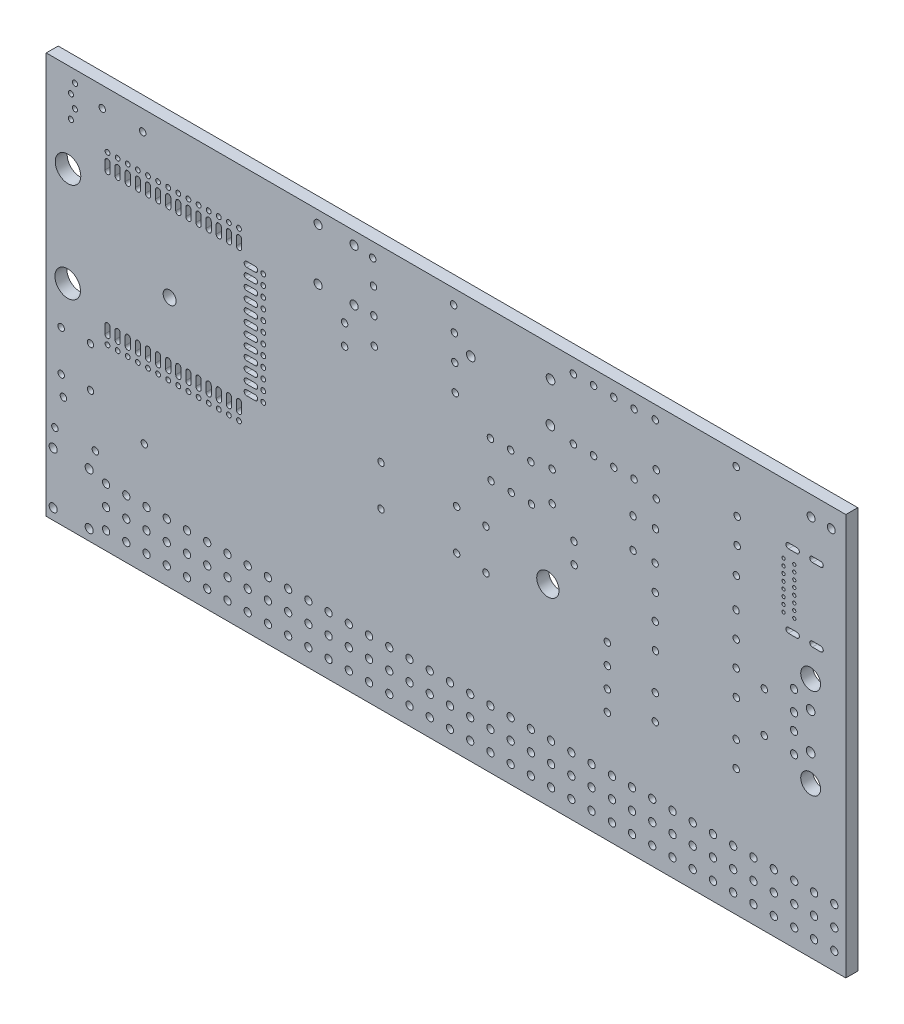
from build123d import *

# Parameters (mm, degrees)
SKETCH1_W           = 100.4
SKETCH1_H           = 50.4
SKETCH1_R           = 1.604875385
SKETCH1_R_2         = 0.457
SKETCH1_R_3         = 0.406
SKETCH1_R_4         = 0.508
SKETCH1_R_5         = 0.546
SKETCH1_R_6         = 1.4
SKETCH1_R_7         = 1.245
SKETCH1_R_8         = 0.45
SKETCH1_R_9         = 0.3
SKETCH1_R_10        = 0.325
SKETCH1_R_11        = 0.82
SKETCH1_R_12        = 0.203
SKETCH1_R_13        = 0.5
BOSS_EXTRUDE1_DEPTH = 1.5


with BuildPart() as part:
    # Sketch1 → Boss-Extrude1 (new body)
    with BuildSketch(Plane.XY):
        with Locations((51.575, 25.508)):
            Rectangle(SKETCH1_W, SKETCH1_H)
        with Locations((4.108084942, 39.459)):
            Circle(SKETCH1_R, mode=Mode.SUBTRACT)
        with Locations((26.67, 2.54)):
            Circle(SKETCH1_R_2, mode=Mode.SUBTRACT)
        with Locations((29.21, 2.54)):
            Circle(SKETCH1_R_2, mode=Mode.SUBTRACT)
        with Locations((21.59, 7.62)):
            Circle(SKETCH1_R_2, mode=Mode.SUBTRACT)
        with Locations((19.05, 7.62)):
            Circle(SKETCH1_R_2, mode=Mode.SUBTRACT)
        with Locations((24.13, 7.62)):
            Circle(SKETCH1_R_2, mode=Mode.SUBTRACT)
        with Locations((13.691, 14.351)):
            Circle(SKETCH1_R_3, mode=Mode.SUBTRACT)
        with Locations((7.544, 10.516)):
            Circle(SKETCH1_R_3, mode=Mode.SUBTRACT)
        with Locations((13.97, 7.62)):
            Circle(SKETCH1_R_2, mode=Mode.SUBTRACT)
        with Locations((16.51, 7.62)):
            Circle(SKETCH1_R_2, mode=Mode.SUBTRACT)
        with Locations((8.89, 7.62)):
            Circle(SKETCH1_R_2, mode=Mode.SUBTRACT)
        with Locations((11.43, 7.62)):
            Circle(SKETCH1_R_2, mode=Mode.SUBTRACT)
        with Locations((6.934, 21.869)):
            Circle(SKETCH1_R_3, mode=Mode.SUBTRACT)
        with Locations((6.934, 16.789)):
            Circle(SKETCH1_R_3, mode=Mode.SUBTRACT)
        with Locations((3.251, 21.793)):
            Circle(SKETCH1_R_3, mode=Mode.SUBTRACT)
        with Locations((3.251, 16.713)):
            Circle(SKETCH1_R_3, mode=Mode.SUBTRACT)
        with Locations((3.531, 14.351)):
            Circle(SKETCH1_R_3, mode=Mode.SUBTRACT)
        with Locations((6.768, 8.179)):
            Circle(SKETCH1_R_4, mode=Mode.SUBTRACT)
        with Locations((2.464, 10.516)):
            Circle(SKETCH1_R_3, mode=Mode.SUBTRACT)
        with Locations((2.247, 8.179)):
            Circle(SKETCH1_R_4, mode=Mode.SUBTRACT)
        with Locations((24.13, 5.08)):
            Circle(SKETCH1_R_2, mode=Mode.SUBTRACT)
        with Locations((21.59, 5.08)):
            Circle(SKETCH1_R_2, mode=Mode.SUBTRACT)
        with Locations((26.67, 5.08)):
            Circle(SKETCH1_R_2, mode=Mode.SUBTRACT)
        with Locations((16.51, 5.08)):
            Circle(SKETCH1_R_2, mode=Mode.SUBTRACT)
        with Locations((19.05, 5.08)):
            Circle(SKETCH1_R_2, mode=Mode.SUBTRACT)
        with Locations((21.59, 2.54)):
            Circle(SKETCH1_R_2, mode=Mode.SUBTRACT)
        with Locations((24.13, 2.54)):
            Circle(SKETCH1_R_2, mode=Mode.SUBTRACT)
        with Locations((16.51, 2.54)):
            Circle(SKETCH1_R_2, mode=Mode.SUBTRACT)
        with Locations((19.05, 2.54)):
            Circle(SKETCH1_R_2, mode=Mode.SUBTRACT)
        with Locations((13.97, 5.08)):
            Circle(SKETCH1_R_2, mode=Mode.SUBTRACT)
        with Locations((13.97, 2.54)):
            Circle(SKETCH1_R_2, mode=Mode.SUBTRACT)
        with Locations((8.89, 5.08)):
            Circle(SKETCH1_R_2, mode=Mode.SUBTRACT)
        with Locations((11.43, 5.08)):
            Circle(SKETCH1_R_2, mode=Mode.SUBTRACT)
        with Locations((8.89, 2.54)):
            Circle(SKETCH1_R_2, mode=Mode.SUBTRACT)
        with Locations((11.43, 2.54)):
            Circle(SKETCH1_R_2, mode=Mode.SUBTRACT)
        with Locations((2.247, 1.676)):
            Circle(SKETCH1_R_4, mode=Mode.SUBTRACT)
        with Locations((6.768, 1.676)):
            Circle(SKETCH1_R_4, mode=Mode.SUBTRACT)
        with Locations((75.184, 48.895)):
            Circle(SKETCH1_R_3, mode=Mode.SUBTRACT)
        with Locations((77.978, 43.688)):
            Circle(SKETCH1_R_3, mode=Mode.SUBTRACT)
        with Locations((72.644, 48.895)):
            Circle(SKETCH1_R_3, mode=Mode.SUBTRACT)
        with Locations((75.184, 41.275)):
            Circle(SKETCH1_R_3, mode=Mode.SUBTRACT)
        with Locations((77.978, 40.513)):
            Circle(SKETCH1_R_3, mode=Mode.SUBTRACT)
        with Locations((77.876, 37.211)):
            Circle(SKETCH1_R_3, mode=Mode.SUBTRACT)
        with Locations((72.644, 41.275)):
            Circle(SKETCH1_R_3, mode=Mode.SUBTRACT)
        with Locations((75.057, 37.211)):
            Circle(SKETCH1_R_3, mode=Mode.SUBTRACT)
        with Locations((67.564, 48.895)):
            Circle(SKETCH1_R_3, mode=Mode.SUBTRACT)
        with Locations((70.104, 48.895)):
            Circle(SKETCH1_R_3, mode=Mode.SUBTRACT)
        with Locations((64.7, 46.874)):
            Circle(SKETCH1_R_5, mode=Mode.SUBTRACT)
        with Locations((64.68, 41.874)):
            Circle(SKETCH1_R_5, mode=Mode.SUBTRACT)
        with Locations((67.564, 41.275)):
            Circle(SKETCH1_R_3, mode=Mode.SUBTRACT)
        with Locations((70.104, 41.275)):
            Circle(SKETCH1_R_3, mode=Mode.SUBTRACT)
        with Locations((64.897, 37.211)):
            Circle(SKETCH1_R_3, mode=Mode.SUBTRACT)
        with Locations((57.15, 36.678)):
            Circle(SKETCH1_R_3, mode=Mode.SUBTRACT)
        with Locations((87.986, 33.452)):
            Circle(SKETCH1_R_3, mode=Mode.SUBTRACT)
        with Locations((77.826, 33.452)):
            Circle(SKETCH1_R_3, mode=Mode.SUBTRACT)
        with Locations((77.851, 30.277)):
            Circle(SKETCH1_R_3, mode=Mode.SUBTRACT)
        with Locations((75.057, 33.452)):
            Circle(SKETCH1_R_3, mode=Mode.SUBTRACT)
        with Locations((67.64, 30.734)):
            Circle(SKETCH1_R_3, mode=Mode.SUBTRACT)
        with Locations((88.011, 30.277)):
            Circle(SKETCH1_R_3, mode=Mode.SUBTRACT)
        with Locations((77.876, 23.952)):
            Circle(SKETCH1_R_3, mode=Mode.SUBTRACT)
        with Locations((67.666, 28.194)):
            Circle(SKETCH1_R_3, mode=Mode.SUBTRACT)
        with Locations((77.851, 27.127)):
            Circle(SKETCH1_R_3, mode=Mode.SUBTRACT)
        with Locations((64.897, 33.452)):
            Circle(SKETCH1_R_3, mode=Mode.SUBTRACT)
        with Locations((62.306, 32.106)):
            Circle(SKETCH1_R_3, mode=Mode.SUBTRACT)
        with Locations((59.69, 36.678)):
            Circle(SKETCH1_R_3, mode=Mode.SUBTRACT)
        with Locations((62.23, 36.678)):
            Circle(SKETCH1_R_3, mode=Mode.SUBTRACT)
        with Locations((59.766, 32.106)):
            Circle(SKETCH1_R_3, mode=Mode.SUBTRACT)
        with Locations((64.364, 24.435)):
            Circle(SKETCH1_R_6, mode=Mode.SUBTRACT)
        with Locations((57.226, 32.106)):
            Circle(SKETCH1_R_3, mode=Mode.SUBTRACT)
        with Locations((56.591, 26.848)):
            Circle(SKETCH1_R_3, mode=Mode.SUBTRACT)
        with Locations((97.358, 19.253)):
            Circle(SKETCH1_R_7, mode=Mode.SUBTRACT)
        with Locations((95.301, 7.645)):
            Circle(SKETCH1_R_2, mode=Mode.SUBTRACT)
        with Locations((97.79, 7.62)):
            Circle(SKETCH1_R_2, mode=Mode.SUBTRACT)
        with Locations((91.542, 21.565)):
            Circle(SKETCH1_R_3, mode=Mode.SUBTRACT)
        with Locations((95.275, 21.387)):
            Circle(SKETCH1_R_8, mode=Mode.SUBTRACT)
        with Locations((100.33, 7.62)):
            Circle(SKETCH1_R_2, mode=Mode.SUBTRACT)
        with Locations((95.301, 5.105)):
            Circle(SKETCH1_R_2, mode=Mode.SUBTRACT)
        with Locations((90.17, 7.62)):
            Circle(SKETCH1_R_2, mode=Mode.SUBTRACT)
        with Locations((92.735, 7.62)):
            Circle(SKETCH1_R_2, mode=Mode.SUBTRACT)
        with Locations((88.011, 19.38)):
            Circle(SKETCH1_R_3, mode=Mode.SUBTRACT)
        with Locations((88.011, 16.205)):
            Circle(SKETCH1_R_3, mode=Mode.SUBTRACT)
        with Locations((77.851, 19.38)):
            Circle(SKETCH1_R_3, mode=Mode.SUBTRACT)
        with Locations((77.851, 16.205)):
            Circle(SKETCH1_R_3, mode=Mode.SUBTRACT)
        with Locations((85.09, 7.62)):
            Circle(SKETCH1_R_2, mode=Mode.SUBTRACT)
        with Locations((87.63, 7.62)):
            Circle(SKETCH1_R_2, mode=Mode.SUBTRACT)
        with Locations((80.01, 7.62)):
            Circle(SKETCH1_R_2, mode=Mode.SUBTRACT)
        with Locations((82.55, 7.62)):
            Circle(SKETCH1_R_2, mode=Mode.SUBTRACT)
        with Locations((100.33, 5.08)):
            Circle(SKETCH1_R_2, mode=Mode.SUBTRACT)
        with Locations((97.79, 5.08)):
            Circle(SKETCH1_R_2, mode=Mode.SUBTRACT)
        with Locations((95.301, 2.565)):
            Circle(SKETCH1_R_2, mode=Mode.SUBTRACT)
        with Locations((90.17, 5.08)):
            Circle(SKETCH1_R_2, mode=Mode.SUBTRACT)
        with Locations((92.735, 5.08)):
            Circle(SKETCH1_R_2, mode=Mode.SUBTRACT)
        with Locations((97.79, 2.54)):
            Circle(SKETCH1_R_2, mode=Mode.SUBTRACT)
        with Locations((100.33, 2.54)):
            Circle(SKETCH1_R_2, mode=Mode.SUBTRACT)
        with Locations((90.17, 2.54)):
            Circle(SKETCH1_R_2, mode=Mode.SUBTRACT)
        with Locations((92.735, 2.54)):
            Circle(SKETCH1_R_2, mode=Mode.SUBTRACT)
        with Locations((85.09, 5.08)):
            Circle(SKETCH1_R_2, mode=Mode.SUBTRACT)
        with Locations((87.63, 5.08)):
            Circle(SKETCH1_R_2, mode=Mode.SUBTRACT)
        with Locations((80.01, 5.08)):
            Circle(SKETCH1_R_2, mode=Mode.SUBTRACT)
        with Locations((82.55, 5.08)):
            Circle(SKETCH1_R_2, mode=Mode.SUBTRACT)
        with Locations((85.09, 2.54)):
            Circle(SKETCH1_R_2, mode=Mode.SUBTRACT)
        with Locations((87.63, 2.54)):
            Circle(SKETCH1_R_2, mode=Mode.SUBTRACT)
        with Locations((80.01, 2.54)):
            Circle(SKETCH1_R_2, mode=Mode.SUBTRACT)
        with Locations((82.55, 2.54)):
            Circle(SKETCH1_R_2, mode=Mode.SUBTRACT)
        with Locations((71.832, 14.226)):
            Circle(SKETCH1_R_3, mode=Mode.SUBTRACT)
        with Locations((71.832, 16.766)):
            Circle(SKETCH1_R_3, mode=Mode.SUBTRACT)
        with Locations((77.47, 7.645)):
            Circle(SKETCH1_R_2, mode=Mode.SUBTRACT)
        with Locations((71.832, 21.846)):
            Circle(SKETCH1_R_3, mode=Mode.SUBTRACT)
        with Locations((71.832, 19.306)):
            Circle(SKETCH1_R_3, mode=Mode.SUBTRACT)
        with Locations((74.93, 7.62)):
            Circle(SKETCH1_R_2, mode=Mode.SUBTRACT)
        with Locations((77.47, 5.105)):
            Circle(SKETCH1_R_2, mode=Mode.SUBTRACT)
        with Locations((69.85, 7.62)):
            Circle(SKETCH1_R_2, mode=Mode.SUBTRACT)
        with Locations((72.415, 7.62)):
            Circle(SKETCH1_R_2, mode=Mode.SUBTRACT)
        with Locations((64.77, 7.62)):
            Circle(SKETCH1_R_2, mode=Mode.SUBTRACT)
        with Locations((67.31, 7.62)):
            Circle(SKETCH1_R_2, mode=Mode.SUBTRACT)
        with Locations((56.591, 21.768)):
            Circle(SKETCH1_R_3, mode=Mode.SUBTRACT)
        with Locations((62.23, 7.62)):
            Circle(SKETCH1_R_2, mode=Mode.SUBTRACT)
        with Locations((59.69, 7.62)):
            Circle(SKETCH1_R_2, mode=Mode.SUBTRACT)
        with Locations((69.85, 5.08)):
            Circle(SKETCH1_R_2, mode=Mode.SUBTRACT)
        with Locations((54.61, 7.62)):
            Circle(SKETCH1_R_2, mode=Mode.SUBTRACT)
        with Locations((57.15, 7.62)):
            Circle(SKETCH1_R_2, mode=Mode.SUBTRACT)
        with Locations((74.93, 5.08)):
            Circle(SKETCH1_R_2, mode=Mode.SUBTRACT)
        with Locations((72.415, 5.08)):
            Circle(SKETCH1_R_2, mode=Mode.SUBTRACT)
        with Locations((77.47, 2.565)):
            Circle(SKETCH1_R_2, mode=Mode.SUBTRACT)
        with Locations((64.77, 5.08)):
            Circle(SKETCH1_R_2, mode=Mode.SUBTRACT)
        with Locations((67.31, 5.08)):
            Circle(SKETCH1_R_2, mode=Mode.SUBTRACT)
        with Locations((72.415, 2.54)):
            Circle(SKETCH1_R_2, mode=Mode.SUBTRACT)
        with Locations((74.93, 2.54)):
            Circle(SKETCH1_R_2, mode=Mode.SUBTRACT)
        with Locations((67.31, 2.54)):
            Circle(SKETCH1_R_2, mode=Mode.SUBTRACT)
        with Locations((69.85, 2.54)):
            Circle(SKETCH1_R_2, mode=Mode.SUBTRACT)
        with Locations((59.69, 5.08)):
            Circle(SKETCH1_R_2, mode=Mode.SUBTRACT)
        with Locations((62.23, 5.08)):
            Circle(SKETCH1_R_2, mode=Mode.SUBTRACT)
        with Locations((57.15, 5.08)):
            Circle(SKETCH1_R_2, mode=Mode.SUBTRACT)
        with Locations((54.61, 2.54)):
            Circle(SKETCH1_R_2, mode=Mode.SUBTRACT)
        with Locations((62.23, 2.54)):
            Circle(SKETCH1_R_2, mode=Mode.SUBTRACT)
        with Locations((64.77, 2.54)):
            Circle(SKETCH1_R_2, mode=Mode.SUBTRACT)
        with Locations((57.15, 2.54)):
            Circle(SKETCH1_R_2, mode=Mode.SUBTRACT)
        with Locations((59.69, 2.54)):
            Circle(SKETCH1_R_2, mode=Mode.SUBTRACT)
        with Locations((52.629, 45.898)):
            Circle(SKETCH1_R_3, mode=Mode.SUBTRACT)
        with Locations((52.527, 48.895)):
            Circle(SKETCH1_R_3, mode=Mode.SUBTRACT)
        with Locations((54.69, 44.374)):
            Circle(SKETCH1_R_5, mode=Mode.SUBTRACT)
        with Locations((42.367, 48.895)):
            Circle(SKETCH1_R_3, mode=Mode.SUBTRACT)
        with Locations((42.469, 45.898)):
            Circle(SKETCH1_R_3, mode=Mode.SUBTRACT)
        with Locations((52.68, 42.697)):
            Circle(SKETCH1_R_3, mode=Mode.SUBTRACT)
        with Locations((52.73, 39.421)):
            Circle(SKETCH1_R_3, mode=Mode.SUBTRACT)
        with Locations((42.52, 42.697)):
            Circle(SKETCH1_R_3, mode=Mode.SUBTRACT)
        with Locations((42.57, 39.421)):
            Circle(SKETCH1_R_3, mode=Mode.SUBTRACT)
        with Locations((40.03, 49.124)):
            Circle(SKETCH1_R_4, mode=Mode.SUBTRACT)
        with Locations((35.509, 49.124)):
            Circle(SKETCH1_R_4, mode=Mode.SUBTRACT)
        with Locations((25.581, 43.739)):
            Circle(SKETCH1_R_9, mode=Mode.SUBTRACT)
        with Locations((23.041, 43.739)):
            Circle(SKETCH1_R_9, mode=Mode.SUBTRACT)
        with Locations((24.311, 43.739)):
            Circle(SKETCH1_R_9, mode=Mode.SUBTRACT)
        with Locations((40.03, 42.621)):
            Circle(SKETCH1_R_4, mode=Mode.SUBTRACT)
        with Locations((38.837, 40.081)):
            Circle(SKETCH1_R_3, mode=Mode.SUBTRACT)
        with Locations((35.509, 42.621)):
            Circle(SKETCH1_R_4, mode=Mode.SUBTRACT)
        with Locations((28.626, 40.304)):
            Circle(SKETCH1_R_9, mode=Mode.SUBTRACT)
        with Locations((28.626, 37.764)):
            Circle(SKETCH1_R_9, mode=Mode.SUBTRACT)
        with Locations((28.626, 39.034)):
            Circle(SKETCH1_R_9, mode=Mode.SUBTRACT)
        with Locations((38.837, 37.541)):
            Circle(SKETCH1_R_3, mode=Mode.SUBTRACT)
        with Locations((28.626, 35.224)):
            Circle(SKETCH1_R_9, mode=Mode.SUBTRACT)
        with Locations((28.626, 33.954)):
            Circle(SKETCH1_R_9, mode=Mode.SUBTRACT)
        with Locations((43.409, 27.203)):
            Circle(SKETCH1_R_3, mode=Mode.SUBTRACT)
        with Locations((52.908, 27.153)):
            Circle(SKETCH1_R_3, mode=Mode.SUBTRACT)
        with Locations((28.626, 32.684)):
            Circle(SKETCH1_R_9, mode=Mode.SUBTRACT)
        with Locations((43.409, 22.123)):
            Circle(SKETCH1_R_3, mode=Mode.SUBTRACT)
        with Locations((28.626, 30.144)):
            Circle(SKETCH1_R_9, mode=Mode.SUBTRACT)
        with Locations((28.626, 28.874)):
            Circle(SKETCH1_R_9, mode=Mode.SUBTRACT)
        with Locations((28.626, 36.494)):
            Circle(SKETCH1_R_9, mode=Mode.SUBTRACT)
        with Locations((28.626, 31.414)):
            Circle(SKETCH1_R_9, mode=Mode.SUBTRACT)
        with Locations((28.626, 27.604)):
            Circle(SKETCH1_R_9, mode=Mode.SUBTRACT)
        with Locations((28.626, 26.334)):
            Circle(SKETCH1_R_9, mode=Mode.SUBTRACT)
        with Locations((24.311, 22.809)):
            Circle(SKETCH1_R_9, mode=Mode.SUBTRACT)
        with Locations((25.581, 22.809)):
            Circle(SKETCH1_R_9, mode=Mode.SUBTRACT)
        with Locations((20.501, 43.739)):
            Circle(SKETCH1_R_9, mode=Mode.SUBTRACT)
        with Locations((19.231, 43.739)):
            Circle(SKETCH1_R_9, mode=Mode.SUBTRACT)
        with Locations((21.771, 43.739)):
            Circle(SKETCH1_R_9, mode=Mode.SUBTRACT)
        with Locations((13.487, 48.184)):
            Circle(SKETCH1_R_3, mode=Mode.SUBTRACT)
        with Locations((17.961, 43.739)):
            Circle(SKETCH1_R_9, mode=Mode.SUBTRACT)
        with Locations((15.421, 43.739)):
            Circle(SKETCH1_R_9, mode=Mode.SUBTRACT)
        with Locations((16.691, 43.739)):
            Circle(SKETCH1_R_9, mode=Mode.SUBTRACT)
        with Locations((12.881, 43.739)):
            Circle(SKETCH1_R_9, mode=Mode.SUBTRACT)
        with Locations((14.151, 43.739)):
            Circle(SKETCH1_R_9, mode=Mode.SUBTRACT)
        with Locations((4.98, 49.219)):
            Circle(SKETCH1_R_10, mode=Mode.SUBTRACT)
        with Locations((8.407, 48.184)):
            Circle(SKETCH1_R_3, mode=Mode.SUBTRACT)
        with Locations((4.472, 47.822)):
            Circle(SKETCH1_R_10, mode=Mode.SUBTRACT)
        with Locations((4.98, 46.425)):
            Circle(SKETCH1_R_10, mode=Mode.SUBTRACT)
        with Locations((10.341, 43.739)):
            Circle(SKETCH1_R_9, mode=Mode.SUBTRACT)
        with Locations((11.611, 43.739)):
            Circle(SKETCH1_R_9, mode=Mode.SUBTRACT)
        with Locations((4.472, 45.028)):
            Circle(SKETCH1_R_10, mode=Mode.SUBTRACT)
        with Locations((9.071, 43.739)):
            Circle(SKETCH1_R_9, mode=Mode.SUBTRACT)
        with Locations((21.771, 22.809)):
            Circle(SKETCH1_R_9, mode=Mode.SUBTRACT)
        with Locations((20.501, 22.809)):
            Circle(SKETCH1_R_9, mode=Mode.SUBTRACT)
        with Locations((23.041, 22.809)):
            Circle(SKETCH1_R_9, mode=Mode.SUBTRACT)
        with Locations((16.871, 31.862)):
            Circle(SKETCH1_R_11, mode=Mode.SUBTRACT)
        with Locations((19.231, 22.809)):
            Circle(SKETCH1_R_9, mode=Mode.SUBTRACT)
        with Locations((16.691, 22.809)):
            Circle(SKETCH1_R_9, mode=Mode.SUBTRACT)
        with Locations((17.961, 22.809)):
            Circle(SKETCH1_R_9, mode=Mode.SUBTRACT)
        with Locations((14.151, 22.809)):
            Circle(SKETCH1_R_9, mode=Mode.SUBTRACT)
        with Locations((15.421, 22.809)):
            Circle(SKETCH1_R_9, mode=Mode.SUBTRACT)
        with Locations((95.301, 36.182)):
            Circle(SKETCH1_R_12, mode=Mode.SUBTRACT)
        with Locations((97.358, 27.229)):
            Circle(SKETCH1_R_5, mode=Mode.SUBTRACT)
        with Locations((97.358, 22.644)):
            Circle(SKETCH1_R_5, mode=Mode.SUBTRACT)
        with Locations((95.275, 25.959)):
            Circle(SKETCH1_R_8, mode=Mode.SUBTRACT)
        with Locations((95.275, 23.927)):
            Circle(SKETCH1_R_8, mode=Mode.SUBTRACT)
        with Locations((93.955, 37.859)):
            Circle(SKETCH1_R_12, mode=Mode.SUBTRACT)
        with Locations((93.955, 37.02)):
            Circle(SKETCH1_R_12, mode=Mode.SUBTRACT)
        with Locations((88.036, 37.211)):
            Circle(SKETCH1_R_3, mode=Mode.SUBTRACT)
        with Locations((93.955, 36.182)):
            Circle(SKETCH1_R_12, mode=Mode.SUBTRACT)
        with Locations((91.542, 26.645)):
            Circle(SKETCH1_R_3, mode=Mode.SUBTRACT)
        with Locations((88.011, 27.127)):
            Circle(SKETCH1_R_3, mode=Mode.SUBTRACT)
        with Locations((88.036, 23.952)):
            Circle(SKETCH1_R_3, mode=Mode.SUBTRACT)
        with Locations((77.851, 49.047)):
            Circle(SKETCH1_R_3, mode=Mode.SUBTRACT)
        with Locations((95.301, 38.697)):
            Circle(SKETCH1_R_12, mode=Mode.SUBTRACT)
        with Locations((95.301, 37.859)):
            Circle(SKETCH1_R_12, mode=Mode.SUBTRACT)
        with Locations((95.301, 40.373)):
            Circle(SKETCH1_R_12, mode=Mode.SUBTRACT)
        with Locations((95.301, 39.535)):
            Circle(SKETCH1_R_12, mode=Mode.SUBTRACT)
        with Locations((93.955, 42.05)):
            Circle(SKETCH1_R_12, mode=Mode.SUBTRACT)
        with Locations((93.955, 41.212)):
            Circle(SKETCH1_R_12, mode=Mode.SUBTRACT)
        with Locations((88.011, 49.047)):
            Circle(SKETCH1_R_3, mode=Mode.SUBTRACT)
        with Locations((88.138, 43.688)):
            Circle(SKETCH1_R_3, mode=Mode.SUBTRACT)
        with Locations((93.955, 40.373)):
            Circle(SKETCH1_R_12, mode=Mode.SUBTRACT)
        with Locations((93.955, 39.535)):
            Circle(SKETCH1_R_12, mode=Mode.SUBTRACT)
        with Locations((88.138, 40.513)):
            Circle(SKETCH1_R_3, mode=Mode.SUBTRACT)
        with Locations((93.955, 38.697)):
            Circle(SKETCH1_R_12, mode=Mode.SUBTRACT)
        with Locations((97.358, 30.632)):
            Circle(SKETCH1_R_7, mode=Mode.SUBTRACT)
        with Locations((95.275, 28.499)):
            Circle(SKETCH1_R_8, mode=Mode.SUBTRACT)
        with Locations((95.301, 37.02)):
            Circle(SKETCH1_R_12, mode=Mode.SUBTRACT)
        with Locations((34.29, 2.54)):
            Circle(SKETCH1_R_2, mode=Mode.SUBTRACT)
        with Locations((31.75, 2.54)):
            Circle(SKETCH1_R_2, mode=Mode.SUBTRACT)
        with Locations((34.29, 5.08)):
            Circle(SKETCH1_R_2, mode=Mode.SUBTRACT)
        with Locations((31.75, 5.08)):
            Circle(SKETCH1_R_2, mode=Mode.SUBTRACT)
        with Locations((36.83, 2.54)):
            Circle(SKETCH1_R_2, mode=Mode.SUBTRACT)
        with Locations((36.83, 5.08)):
            Circle(SKETCH1_R_2, mode=Mode.SUBTRACT)
        with Locations((41.91, 2.54)):
            Circle(SKETCH1_R_2, mode=Mode.SUBTRACT)
        with Locations((39.37, 2.54)):
            Circle(SKETCH1_R_2, mode=Mode.SUBTRACT)
        with Locations((46.99, 2.54)):
            Circle(SKETCH1_R_2, mode=Mode.SUBTRACT)
        with Locations((44.45, 2.54)):
            Circle(SKETCH1_R_2, mode=Mode.SUBTRACT)
        with Locations((41.91, 5.08)):
            Circle(SKETCH1_R_2, mode=Mode.SUBTRACT)
        with Locations((39.37, 5.08)):
            Circle(SKETCH1_R_2, mode=Mode.SUBTRACT)
        with Locations((49.53, 2.54)):
            Circle(SKETCH1_R_2, mode=Mode.SUBTRACT)
        with Locations((52.07, 5.08)):
            Circle(SKETCH1_R_2, mode=Mode.SUBTRACT)
        with Locations((52.07, 2.54)):
            Circle(SKETCH1_R_2, mode=Mode.SUBTRACT)
        with Locations((29.21, 5.08)):
            Circle(SKETCH1_R_2, mode=Mode.SUBTRACT)
        with Locations((26.67, 7.62)):
            Circle(SKETCH1_R_2, mode=Mode.SUBTRACT)
        with Locations((31.75, 7.62)):
            Circle(SKETCH1_R_2, mode=Mode.SUBTRACT)
        with Locations((29.21, 7.62)):
            Circle(SKETCH1_R_2, mode=Mode.SUBTRACT)
        with Locations((36.83, 7.62)):
            Circle(SKETCH1_R_2, mode=Mode.SUBTRACT)
        with Locations((34.29, 7.62)):
            Circle(SKETCH1_R_2, mode=Mode.SUBTRACT)
        with Locations((41.91, 7.62)):
            Circle(SKETCH1_R_2, mode=Mode.SUBTRACT)
        with Locations((39.37, 7.62)):
            Circle(SKETCH1_R_2, mode=Mode.SUBTRACT)
        with Locations((46.99, 5.08)):
            Circle(SKETCH1_R_2, mode=Mode.SUBTRACT)
        with Locations((44.45, 5.08)):
            Circle(SKETCH1_R_2, mode=Mode.SUBTRACT)
        with Locations((54.61, 5.08)):
            Circle(SKETCH1_R_2, mode=Mode.SUBTRACT)
        with Locations((49.53, 5.08)):
            Circle(SKETCH1_R_2, mode=Mode.SUBTRACT)
        with Locations((46.99, 7.62)):
            Circle(SKETCH1_R_2, mode=Mode.SUBTRACT)
        with Locations((95.301, 41.212)):
            Circle(SKETCH1_R_12, mode=Mode.SUBTRACT)
        with Locations((95.301, 42.05)):
            Circle(SKETCH1_R_12, mode=Mode.SUBTRACT)
        with Locations((9.071, 22.809)):
            Circle(SKETCH1_R_9, mode=Mode.SUBTRACT)
        with Locations((10.341, 22.809)):
            Circle(SKETCH1_R_9, mode=Mode.SUBTRACT)
        with Locations((52.908, 22.073)):
            Circle(SKETCH1_R_3, mode=Mode.SUBTRACT)
        with Locations((52.07, 7.62)):
            Circle(SKETCH1_R_2, mode=Mode.SUBTRACT)
        with Locations((49.53, 7.62)):
            Circle(SKETCH1_R_2, mode=Mode.SUBTRACT)
        with Locations((44.45, 7.62)):
            Circle(SKETCH1_R_2, mode=Mode.SUBTRACT)
        with Locations((11.611, 22.809)):
            Circle(SKETCH1_R_9, mode=Mode.SUBTRACT)
        with Locations((12.881, 22.809)):
            Circle(SKETCH1_R_9, mode=Mode.SUBTRACT)
        with Locations((97.409, 48.26)):
            Circle(SKETCH1_R_13, mode=Mode.SUBTRACT)
        with Locations((99.949, 48.26)):
            Circle(SKETCH1_R_13, mode=Mode.SUBTRACT)
        with Locations((4.067, 26.975)):
            Circle(SKETCH1_R, mode=Mode.SUBTRACT)
        with BuildLine():
            Line((9.396, 42.714), (9.396, 41.664))
            ThreePointArc((9.396, 41.664), (9.071, 41.339), (8.746, 41.664))
            Line((8.746, 41.664), (8.746, 42.714))
            ThreePointArc((8.746, 42.714), (9.071, 43.039), (9.396, 42.714))
        make_face(mode=Mode.SUBTRACT)
        with BuildLine():
            Line((27.601, 39.979), (26.551, 39.979))
            ThreePointArc((26.551, 39.979), (26.226, 40.304), (26.551, 40.629))
            Line((26.551, 40.629), (27.601, 40.629))
            ThreePointArc((27.601, 40.629), (27.926, 40.304), (27.601, 39.979))
        make_face(mode=Mode.SUBTRACT)
        with BuildLine():
            Line((8.746, 23.834), (8.746, 24.884))
            ThreePointArc((8.746, 24.884), (9.071, 25.209), (9.396, 24.884))
            Line((9.396, 24.884), (9.396, 23.834))
            ThreePointArc((9.396, 23.834), (9.071, 23.509), (8.746, 23.834))
        make_face(mode=Mode.SUBTRACT)
        with BuildLine():
            Line((10.016, 23.834), (10.016, 24.884))
            ThreePointArc((10.016, 24.884), (10.341, 25.209), (10.666, 24.884))
            Line((10.666, 24.884), (10.666, 23.834))
            ThreePointArc((10.666, 23.834), (10.341, 23.509), (10.016, 23.834))
        make_face(mode=Mode.SUBTRACT)
        with BuildLine():
            Line((11.286, 23.834), (11.286, 24.884))
            ThreePointArc((11.286, 24.884), (11.611, 25.209), (11.936, 24.884))
            Line((11.936, 24.884), (11.936, 23.834))
            ThreePointArc((11.936, 23.834), (11.611, 23.509), (11.286, 23.834))
        make_face(mode=Mode.SUBTRACT)
        with BuildLine():
            Line((12.556, 23.834), (12.556, 24.884))
            ThreePointArc((12.556, 24.884), (12.881, 25.209), (13.206, 24.884))
            Line((13.206, 24.884), (13.206, 23.834))
            ThreePointArc((13.206, 23.834), (12.881, 23.509), (12.556, 23.834))
        make_face(mode=Mode.SUBTRACT)
        with BuildLine():
            Line((13.826, 23.834), (13.826, 24.884))
            ThreePointArc((13.826, 24.884), (14.151, 25.209), (14.476, 24.884))
            Line((14.476, 24.884), (14.476, 23.834))
            ThreePointArc((14.476, 23.834), (14.151, 23.509), (13.826, 23.834))
        make_face(mode=Mode.SUBTRACT)
        with BuildLine():
            Line((15.096, 23.834), (15.096, 24.884))
            ThreePointArc((15.096, 24.884), (15.421, 25.209), (15.746, 24.884))
            Line((15.746, 24.884), (15.746, 23.834))
            ThreePointArc((15.746, 23.834), (15.421, 23.509), (15.096, 23.834))
        make_face(mode=Mode.SUBTRACT)
        with BuildLine():
            Line((16.366, 23.834), (16.366, 24.884))
            ThreePointArc((16.366, 24.884), (16.691, 25.209), (17.016, 24.884))
            Line((17.016, 24.884), (17.016, 23.834))
            ThreePointArc((17.016, 23.834), (16.691, 23.509), (16.366, 23.834))
        make_face(mode=Mode.SUBTRACT)
        with BuildLine():
            Line((17.636, 23.834), (17.636, 24.884))
            ThreePointArc((17.636, 24.884), (17.961, 25.209), (18.286, 24.884))
            Line((18.286, 24.884), (18.286, 23.834))
            ThreePointArc((18.286, 23.834), (17.961, 23.509), (17.636, 23.834))
        make_face(mode=Mode.SUBTRACT)
        with BuildLine():
            Line((18.906, 23.834), (18.906, 24.884))
            ThreePointArc((18.906, 24.884), (19.231, 25.209), (19.556, 24.884))
            Line((19.556, 24.884), (19.556, 23.834))
            ThreePointArc((19.556, 23.834), (19.231, 23.509), (18.906, 23.834))
        make_face(mode=Mode.SUBTRACT)
        with BuildLine():
            Line((20.176, 23.834), (20.176, 24.884))
            ThreePointArc((20.176, 24.884), (20.501, 25.209), (20.826, 24.884))
            Line((20.826, 24.884), (20.826, 23.834))
            ThreePointArc((20.826, 23.834), (20.501, 23.509), (20.176, 23.834))
        make_face(mode=Mode.SUBTRACT)
        with BuildLine():
            Line((21.446, 23.834), (21.446, 24.884))
            ThreePointArc((21.446, 24.884), (21.771, 25.209), (22.096, 24.884))
            Line((22.096, 24.884), (22.096, 23.834))
            ThreePointArc((22.096, 23.834), (21.771, 23.509), (21.446, 23.834))
        make_face(mode=Mode.SUBTRACT)
        with BuildLine():
            Line((22.716, 23.834), (22.716, 24.884))
            ThreePointArc((22.716, 24.884), (23.041, 25.209), (23.366, 24.884))
            Line((23.366, 24.884), (23.366, 23.834))
            ThreePointArc((23.366, 23.834), (23.041, 23.509), (22.716, 23.834))
        make_face(mode=Mode.SUBTRACT)
        with BuildLine():
            Line((23.986, 23.834), (23.986, 24.884))
            ThreePointArc((23.986, 24.884), (24.311, 25.209), (24.636, 24.884))
            Line((24.636, 24.884), (24.636, 23.834))
            ThreePointArc((24.636, 23.834), (24.311, 23.509), (23.986, 23.834))
        make_face(mode=Mode.SUBTRACT)
        with BuildLine():
            Line((25.256, 23.834), (25.256, 24.884))
            ThreePointArc((25.256, 24.884), (25.581, 25.209), (25.906, 24.884))
            Line((25.906, 24.884), (25.906, 23.834))
            ThreePointArc((25.906, 23.834), (25.581, 23.509), (25.256, 23.834))
        make_face(mode=Mode.SUBTRACT)
        with BuildLine():
            Line((10.666, 42.714), (10.666, 41.664))
            ThreePointArc((10.666, 41.664), (10.341, 41.339), (10.016, 41.664))
            Line((10.016, 41.664), (10.016, 42.714))
            ThreePointArc((10.016, 42.714), (10.341, 43.039), (10.666, 42.714))
        make_face(mode=Mode.SUBTRACT)
        with BuildLine():
            Line((11.936, 42.714), (11.936, 41.664))
            ThreePointArc((11.936, 41.664), (11.611, 41.339), (11.286, 41.664))
            Line((11.286, 41.664), (11.286, 42.714))
            ThreePointArc((11.286, 42.714), (11.611, 43.039), (11.936, 42.714))
        make_face(mode=Mode.SUBTRACT)
        with BuildLine():
            Line((13.206, 42.714), (13.206, 41.664))
            ThreePointArc((13.206, 41.664), (12.881, 41.339), (12.556, 41.664))
            Line((12.556, 41.664), (12.556, 42.714))
            ThreePointArc((12.556, 42.714), (12.881, 43.039), (13.206, 42.714))
        make_face(mode=Mode.SUBTRACT)
        with BuildLine():
            Line((14.476, 42.714), (14.476, 41.664))
            ThreePointArc((14.476, 41.664), (14.151, 41.339), (13.826, 41.664))
            Line((13.826, 41.664), (13.826, 42.714))
            ThreePointArc((13.826, 42.714), (14.151, 43.039), (14.476, 42.714))
        make_face(mode=Mode.SUBTRACT)
        with BuildLine():
            Line((15.746, 42.714), (15.746, 41.664))
            ThreePointArc((15.746, 41.664), (15.421, 41.339), (15.096, 41.664))
            Line((15.096, 41.664), (15.096, 42.714))
            ThreePointArc((15.096, 42.714), (15.421, 43.039), (15.746, 42.714))
        make_face(mode=Mode.SUBTRACT)
        with BuildLine():
            Line((17.016, 42.714), (17.016, 41.664))
            ThreePointArc((17.016, 41.664), (16.691, 41.339), (16.366, 41.664))
            Line((16.366, 41.664), (16.366, 42.714))
            ThreePointArc((16.366, 42.714), (16.691, 43.039), (17.016, 42.714))
        make_face(mode=Mode.SUBTRACT)
        with BuildLine():
            Line((18.286, 42.714), (18.286, 41.664))
            ThreePointArc((18.286, 41.664), (17.961, 41.339), (17.636, 41.664))
            Line((17.636, 41.664), (17.636, 42.714))
            ThreePointArc((17.636, 42.714), (17.961, 43.039), (18.286, 42.714))
        make_face(mode=Mode.SUBTRACT)
        with BuildLine():
            Line((19.556, 42.714), (19.556, 41.664))
            ThreePointArc((19.556, 41.664), (19.231, 41.339), (18.906, 41.664))
            Line((18.906, 41.664), (18.906, 42.714))
            ThreePointArc((18.906, 42.714), (19.231, 43.039), (19.556, 42.714))
        make_face(mode=Mode.SUBTRACT)
        with BuildLine():
            Line((20.826, 42.714), (20.826, 41.664))
            ThreePointArc((20.826, 41.664), (20.501, 41.339), (20.176, 41.664))
            Line((20.176, 41.664), (20.176, 42.714))
            ThreePointArc((20.176, 42.714), (20.501, 43.039), (20.826, 42.714))
        make_face(mode=Mode.SUBTRACT)
        with BuildLine():
            Line((22.096, 42.714), (22.096, 41.664))
            ThreePointArc((22.096, 41.664), (21.771, 41.339), (21.446, 41.664))
            Line((21.446, 41.664), (21.446, 42.714))
            ThreePointArc((21.446, 42.714), (21.771, 43.039), (22.096, 42.714))
        make_face(mode=Mode.SUBTRACT)
        with BuildLine():
            Line((23.366, 42.714), (23.366, 41.664))
            ThreePointArc((23.366, 41.664), (23.041, 41.339), (22.716, 41.664))
            Line((22.716, 41.664), (22.716, 42.714))
            ThreePointArc((22.716, 42.714), (23.041, 43.039), (23.366, 42.714))
        make_face(mode=Mode.SUBTRACT)
        with BuildLine():
            Line((24.636, 42.714), (24.636, 41.664))
            ThreePointArc((24.636, 41.664), (24.311, 41.339), (23.986, 41.664))
            Line((23.986, 41.664), (23.986, 42.714))
            ThreePointArc((23.986, 42.714), (24.311, 43.039), (24.636, 42.714))
        make_face(mode=Mode.SUBTRACT)
        with BuildLine():
            Line((25.906, 42.714), (25.906, 41.664))
            ThreePointArc((25.906, 41.664), (25.581, 41.339), (25.256, 41.664))
            Line((25.256, 41.664), (25.256, 42.714))
            ThreePointArc((25.256, 42.714), (25.581, 43.039), (25.906, 42.714))
        make_face(mode=Mode.SUBTRACT)
        with BuildLine():
            Line((27.601, 38.709), (26.551, 38.709))
            ThreePointArc((26.551, 38.709), (26.226, 39.034), (26.551, 39.359))
            Line((26.551, 39.359), (27.601, 39.359))
            ThreePointArc((27.601, 39.359), (27.926, 39.034), (27.601, 38.709))
        make_face(mode=Mode.SUBTRACT)
        with BuildLine():
            Line((27.601, 37.439), (26.551, 37.439))
            ThreePointArc((26.551, 37.439), (26.226, 37.764), (26.551, 38.089))
            Line((26.551, 38.089), (27.601, 38.089))
            ThreePointArc((27.601, 38.089), (27.926, 37.764), (27.601, 37.439))
        make_face(mode=Mode.SUBTRACT)
        with BuildLine():
            Line((27.601, 36.169), (26.551, 36.169))
            ThreePointArc((26.551, 36.169), (26.226, 36.494), (26.551, 36.819))
            Line((26.551, 36.819), (27.601, 36.819))
            ThreePointArc((27.601, 36.819), (27.926, 36.494), (27.601, 36.169))
        make_face(mode=Mode.SUBTRACT)
        with BuildLine():
            Line((27.601, 34.899), (26.551, 34.899))
            ThreePointArc((26.551, 34.899), (26.226, 35.224), (26.551, 35.549))
            Line((26.551, 35.549), (27.601, 35.549))
            ThreePointArc((27.601, 35.549), (27.926, 35.224), (27.601, 34.899))
        make_face(mode=Mode.SUBTRACT)
        with BuildLine():
            Line((27.601, 33.629), (26.551, 33.629))
            ThreePointArc((26.551, 33.629), (26.226, 33.954), (26.551, 34.279))
            Line((26.551, 34.279), (27.601, 34.279))
            ThreePointArc((27.601, 34.279), (27.926, 33.954), (27.601, 33.629))
        make_face(mode=Mode.SUBTRACT)
        with BuildLine():
            Line((27.601, 32.359), (26.551, 32.359))
            ThreePointArc((26.551, 32.359), (26.226, 32.684), (26.551, 33.009))
            Line((26.551, 33.009), (27.601, 33.009))
            ThreePointArc((27.601, 33.009), (27.926, 32.684), (27.601, 32.359))
        make_face(mode=Mode.SUBTRACT)
        with BuildLine():
            Line((27.601, 31.089), (26.551, 31.089))
            ThreePointArc((26.551, 31.089), (26.226, 31.414), (26.551, 31.739))
            Line((26.551, 31.739), (27.601, 31.739))
            ThreePointArc((27.601, 31.739), (27.926, 31.414), (27.601, 31.089))
        make_face(mode=Mode.SUBTRACT)
        with BuildLine():
            Line((27.601, 29.819), (26.551, 29.819))
            ThreePointArc((26.551, 29.819), (26.226, 30.144), (26.551, 30.469))
            Line((26.551, 30.469), (27.601, 30.469))
            ThreePointArc((27.601, 30.469), (27.926, 30.144), (27.601, 29.819))
        make_face(mode=Mode.SUBTRACT)
        with BuildLine():
            Line((27.601, 28.549), (26.551, 28.549))
            ThreePointArc((26.551, 28.549), (26.226, 28.874), (26.551, 29.199))
            Line((26.551, 29.199), (27.601, 29.199))
            ThreePointArc((27.601, 29.199), (27.926, 28.874), (27.601, 28.549))
        make_face(mode=Mode.SUBTRACT)
        with BuildLine():
            Line((27.601, 27.279), (26.551, 27.279))
            ThreePointArc((26.551, 27.279), (26.226, 27.604), (26.551, 27.929))
            Line((26.551, 27.929), (27.601, 27.929))
            ThreePointArc((27.601, 27.929), (27.926, 27.604), (27.601, 27.279))
        make_face(mode=Mode.SUBTRACT)
        with BuildLine():
            Line((27.601, 26.009), (26.551, 26.009))
            ThreePointArc((26.551, 26.009), (26.226, 26.334), (26.551, 26.659))
            Line((26.551, 26.659), (27.601, 26.659))
            ThreePointArc((27.601, 26.659), (27.926, 26.334), (27.601, 26.009))
        make_face(mode=Mode.SUBTRACT)
        with BuildLine():
            Line((97.57, 34.844), (98.62, 34.844))
            ThreePointArc((98.62, 34.844), (98.945, 34.519), (98.62, 34.194))
            Line((98.62, 34.194), (97.57, 34.194))
            ThreePointArc((97.57, 34.194), (97.245, 34.519), (97.57, 34.844))
        make_face(mode=Mode.SUBTRACT)
        with BuildLine():
            Line((94.573, 34.844), (95.623, 34.844))
            ThreePointArc((95.623, 34.844), (95.948, 34.519), (95.623, 34.194))
            Line((95.623, 34.194), (94.573, 34.194))
            ThreePointArc((94.573, 34.194), (94.248, 34.519), (94.573, 34.844))
        make_face(mode=Mode.SUBTRACT)
        with BuildLine():
            Line((97.57, 44.044), (98.62, 44.044))
            ThreePointArc((98.62, 44.044), (98.945, 43.719), (98.62, 43.394))
            Line((98.62, 43.394), (97.57, 43.394))
            ThreePointArc((97.57, 43.394), (97.245, 43.719), (97.57, 44.044))
        make_face(mode=Mode.SUBTRACT)
        with BuildLine():
            Line((94.573, 44.038), (95.623, 44.038))
            ThreePointArc((95.623, 44.038), (95.948, 43.713), (95.623, 43.388))
            Line((95.623, 43.388), (94.573, 43.388))
            ThreePointArc((94.573, 43.388), (94.248, 43.713), (94.573, 44.038))
        make_face(mode=Mode.SUBTRACT)
    extrude(amount=BOSS_EXTRUDE1_DEPTH)


solid = part.part
